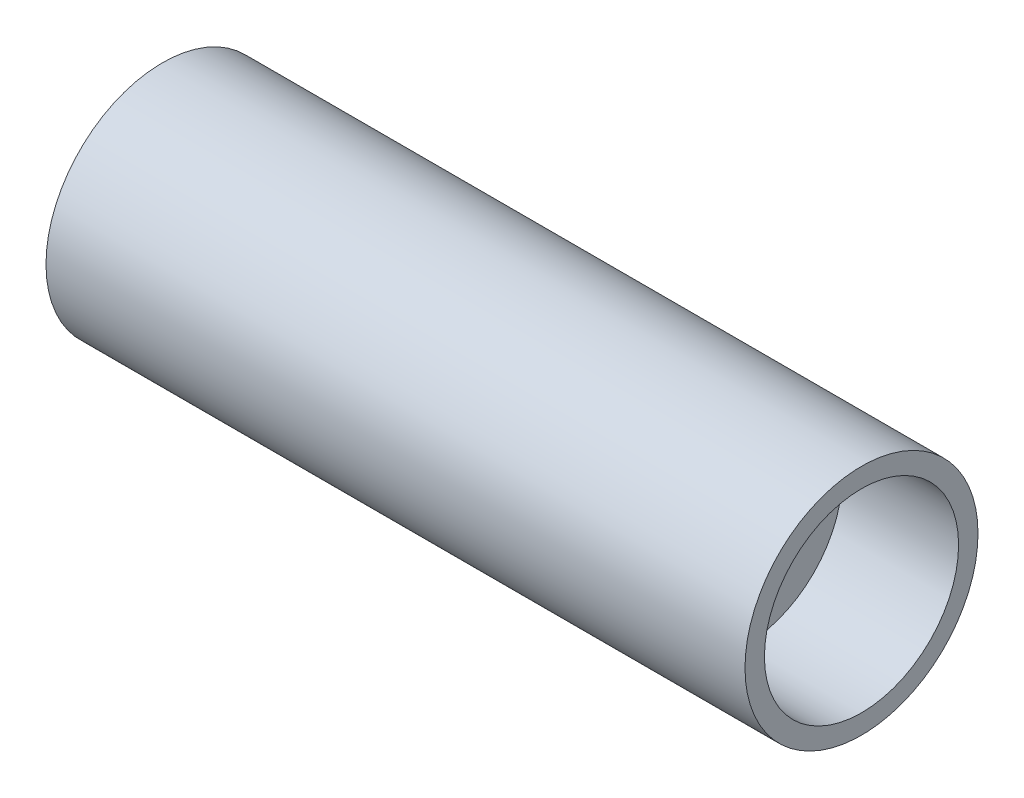
from build123d import *

# Parameters (mm, degrees)
SKETCH1_R           = 3
BOSS_EXTRUDE1_DEPTH = 8
SKETCH2_R           = 2.5
CUT_EXTRUDE1_DEPTH  = 3
CUT_EXTRUDE2_START  = -2
SKETCH3_R           = 2.5
CUT_EXTRUDE2_DEPTH  = 2
SKETCH4_R           = 2.5
BOSS_EXTRUDE2_DEPTH = 10
SKETCH5_R           = 3
SKETCH5_R_2         = 2.5
BOSS_EXTRUDE3_DEPTH = 10


with BuildPart() as part:
    # Sketch1 → Boss-Extrude1 (new body)
    with BuildSketch(Plane(origin=(0, 0, 0), x_dir=(0, 0, -1), z_dir=(1, 0, 0))):
        Circle(SKETCH1_R)
    extrude(amount=BOSS_EXTRUDE1_DEPTH)

    # Sketch2 → Cut-Extrude1 (cut)
    with BuildSketch(Plane(origin=(8, 0, 0), x_dir=(0, 0, -1), z_dir=(1, 0, 0))):
        Circle(SKETCH2_R)
    extrude(amount=-CUT_EXTRUDE1_DEPTH, mode=Mode.SUBTRACT)

    # Sketch3 → Cut-Extrude2 (cut)
    with BuildSketch(Plane.ZY.offset(CUT_EXTRUDE2_START)):
        with Locations(Location((0, 0, 0), (0, 0, 180))):
            Circle(SKETCH3_R)
    extrude(amount=CUT_EXTRUDE2_DEPTH, mode=Mode.SUBTRACT)

    # Sketch4 → Boss-Extrude2 (add)
    with BuildSketch(Plane.ZY.offset(-2)):
        with Locations(Location((0, 0, 0), (0, 0, 180))):
            Circle(SKETCH4_R)
    extrude(amount=BOSS_EXTRUDE2_DEPTH)

    # Sketch5 → Boss-Extrude3 (add)
    with BuildSketch(Plane.ZY):
        Circle(SKETCH5_R)
        with Locations(Location((0, 0, 0), (0, 0, 180))):
            Circle(SKETCH5_R_2, mode=Mode.SUBTRACT)
    extrude(amount=BOSS_EXTRUDE3_DEPTH)


solid = part.part
